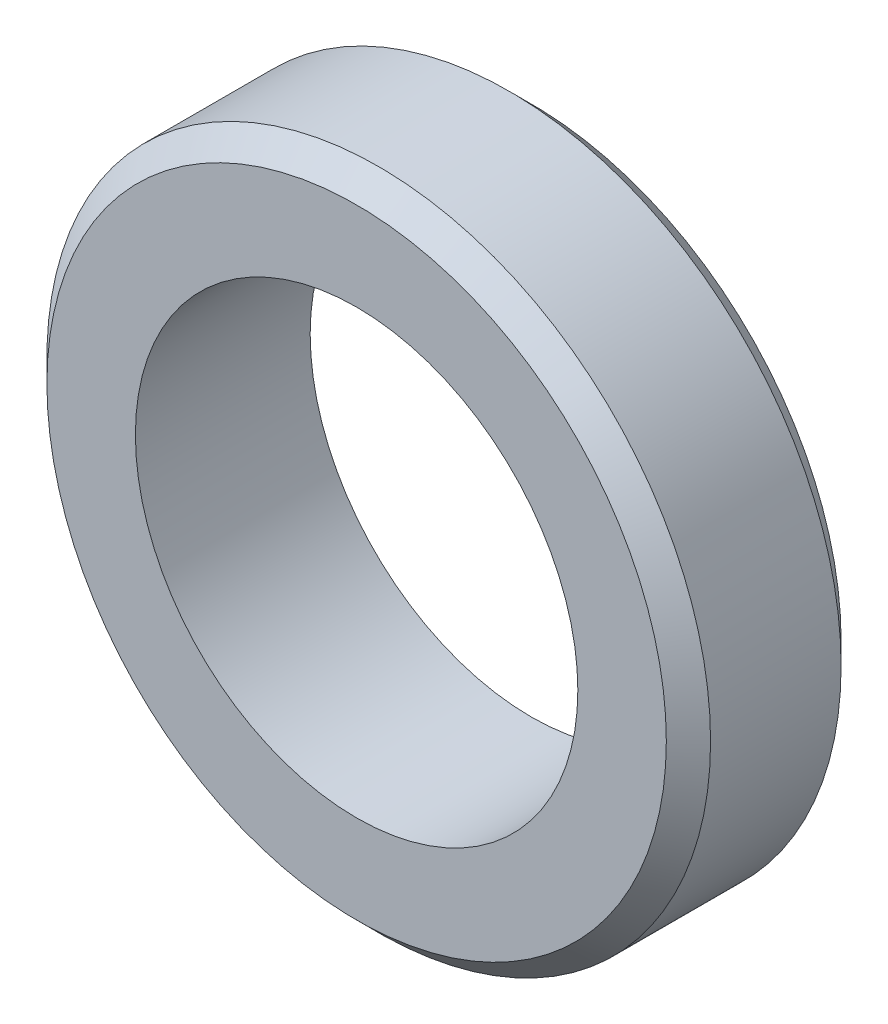
from build123d import *

# Parameters (mm, degrees)
SKETCH1_R           = 19.05
SKETCH1_R_2         = 12.7
BOSS_EXTRUDE1_DEPTH = 10.033
CHAMFER1_SIZE       = 1.27


with BuildPart() as part:
    # Sketch1 → Boss-Extrude1 (new body)
    with BuildSketch(Plane.XY):
        Circle(SKETCH1_R)
        Circle(SKETCH1_R_2, mode=Mode.SUBTRACT)
    extrude(amount=BOSS_EXTRUDE1_DEPTH)

    # Chamfer1
    chamfer1_edges = [part.edges().sort_by_distance(p)[0] for p in [
        (-19.05, 0, 0),
        (-19.05, 0, 10.033),
    ]]
    chamfer(chamfer1_edges, length=CHAMFER1_SIZE)


solid = part.part
